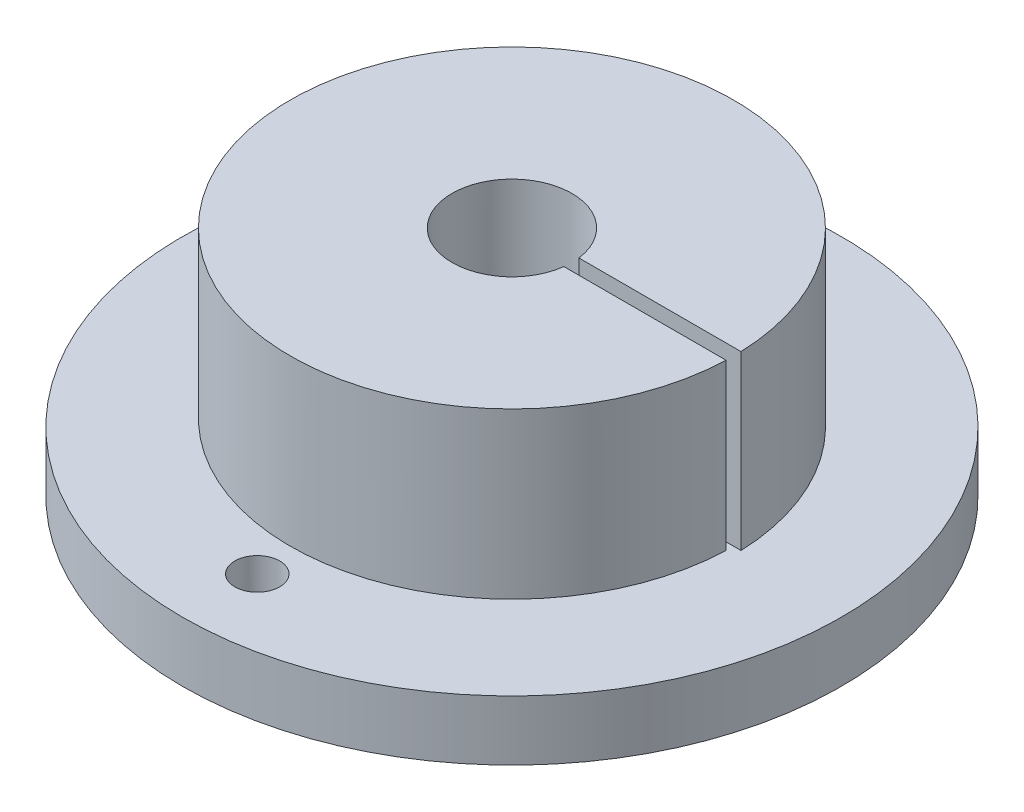
from build123d import *

# Parameters (mm, degrees)
SKETCH_1_R          = 22
EXTRUDE_1_DEPTH     = 4
SKETCH_2_R          = 14.8
EXTRUDE_2_DEPTH     = 11.5
SKETCH_3_R          = 4
CUT_EXTRUDE_1_DEPTH = 35.759890679
SKETCH_4_R          = 1.5
CUT_EXTRUDE_2_DEPTH = 35.759890679
SKETCH_5_W          = 14.8
SKETCH_5_H          = 0.5
CUT_EXTRUDE_3_DEPTH = 15
CUT_EXTRUDE_4_DEPTH = 11.5


with BuildPart() as part:
    # 草图1 → 凸台-拉伸1 (new body)
    with BuildSketch(Plane(origin=(0, 0, 0), x_dir=(1, 0, 0), z_dir=(0, 1, 0))):
        with Locations(Location((0, 0, 0), (0, 0, 270))):
            Circle(SKETCH_1_R)
    extrude(amount=EXTRUDE_1_DEPTH)

    # 草图2 → 凸台-拉伸2 (add)
    with BuildSketch(Plane(origin=(0, 4, 0), x_dir=(1, 0, 0), z_dir=(0, 1, 0))):
        with Locations(Location((0, 0, 0), (0, 0, 270))):
            Circle(SKETCH_2_R)
    extrude(amount=EXTRUDE_2_DEPTH)

    # 草图3 → 切除-拉伸1 (cut, through all)
    with BuildSketch(Plane(origin=(0, 15.5, 0), x_dir=(1, 0, 0), z_dir=(0, 1, 0))):
        with Locations(Location((0, 0, 0), (0, 0, 270))):
            Circle(SKETCH_3_R)
    extrude(amount=-CUT_EXTRUDE_1_DEPTH, mode=Mode.SUBTRACT)

    # 草图4 → 切除-拉伸2 (cut, through all)
    with BuildSketch(Plane.XZ):
        with Locations(Location((0, 17, 0), (0, 0, 270))):
            Circle(SKETCH_4_R)
        with Locations(Location((0, -17, 0), (0, 0, 270))):
            Circle(SKETCH_4_R)
    extrude(amount=-CUT_EXTRUDE_2_DEPTH, mode=Mode.SUBTRACT)

    # 草图5 → 切除-拉伸3 (cut, symmetric)
    with BuildSketch(Plane(origin=(0, 0, 0), x_dir=(0, 0, -1), z_dir=(1, 0, 0))):
        with Locations((-7.4, 4.25)):
            Rectangle(SKETCH_5_W, SKETCH_5_H)
    extrude(amount=CUT_EXTRUDE_3_DEPTH, both=True, mode=Mode.SUBTRACT)

    # 草图6 → 切除-拉伸4 (cut)
    with BuildSketch(Plane(origin=(0, 15.5, 0), x_dir=(1, 0, 0), z_dir=(0, 1, 0))):
        Polygon((0, 0), (0, 0.5), (16.994106536, 0.5), (16.994106536, -0.5), (0, -0.5), align=None)
    extrude(amount=-CUT_EXTRUDE_4_DEPTH, mode=Mode.SUBTRACT)


solid = part.part
